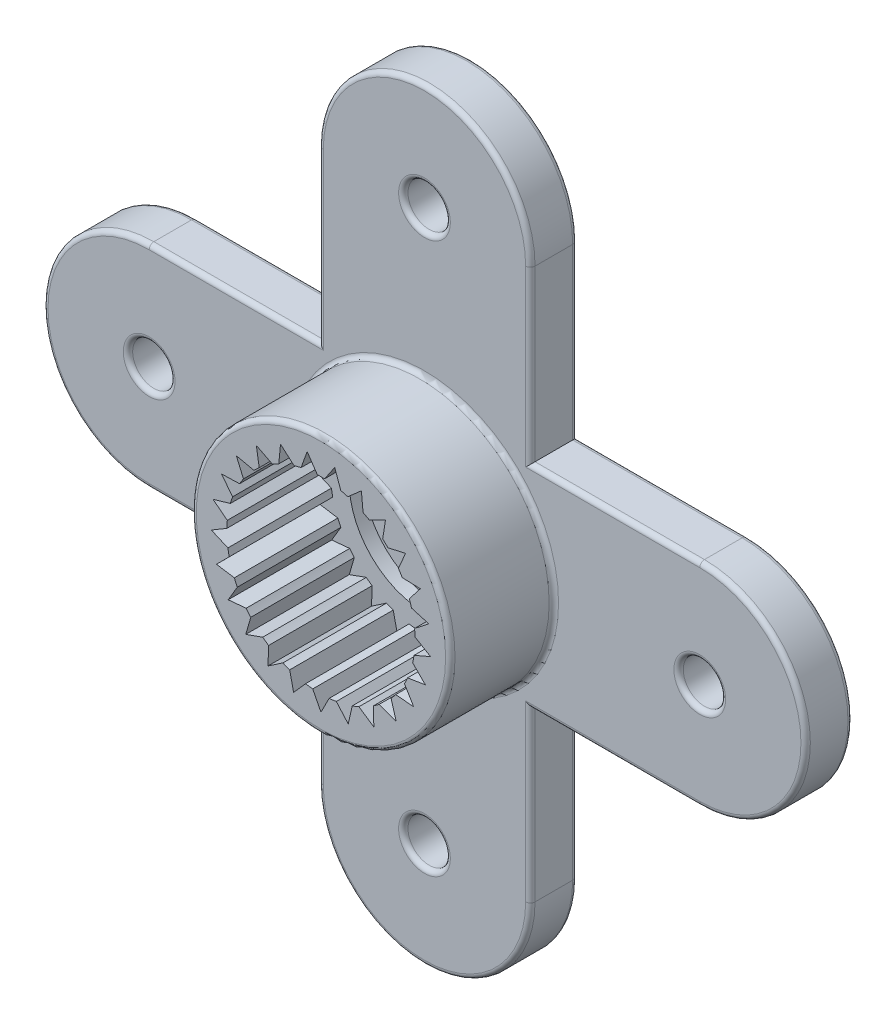
from build123d import *

# Parameters (mm, degrees)
ESQUISSE1_R             = 2.75
BOSS_EXTRU_1_DEPTH      = 1
ESQUISSE2_R             = 2.75
BOSS_EXTRU_2_DEPTH      = 2.2
ESQUISSE3_R             = 2
ENL_V_MAT_EXTRU_1_DEPTH = 2.5
ESQUISSE4_R             = 1.6
ENL_V_MAT_EXTRU_2_DEPTH = 0.4
ESQUISSE5_R             = 0.85
ENL_V_MAT_EXTRU_3_DEPTH = 4.8
ESQUISSE6_R             = 0.45
ENL_V_MAT_EXTRU_4_DEPTH = 10.133044399
CUT_EXTRUDE1_DEPTH      = 2.5
CIRPATTERN1_COUNT       = 25
BOSS_EXTRUDE1_DEPTH     = 1
SKETCH3_R               = 0.45
CUT_EXTRUDE2_DEPTH      = 10.133044399
SKETCH5_R               = 1.6
BOSS_EXTRUDE3_DEPTH     = 1
SKETCH9_R               = 0.45
CUT_EXTRUDE6_DEPTH      = 12.893695809
FILLET5_R               = 0.1


with BuildPart() as part:
    # Esquisse1 → Boss.-Extru.1 (new body)
    with BuildSketch(Plane.XY):
        with BuildLine():
            ThreePointArc((2.25, 5.85), (0, 8.1), (-2.25, 5.85))
            Line((-2.25, 5.85), (-2.25, 1.58113883))
            ThreePointArc((-2.25, 1.58113883), (0, 2.75), (2.25, 1.58113883))
            Line((2.25, 1.58113883), (2.25, 5.85))
        make_face()
        Circle(ESQUISSE1_R)
    extrude(amount=BOSS_EXTRU_1_DEPTH)

    # Esquisse2 → Boss.-Extru.2 (add)
    with BuildSketch(Plane.XY.offset(1)):
        with Locations(Location((0, 0, 0), (0, 0, 144.903198772))):
            Circle(ESQUISSE2_R)
    extrude(amount=BOSS_EXTRU_2_DEPTH)

    # Esquisse3 → Enlèv. mat.-Extru.1 (cut)
    with BuildSketch(Plane.XY.offset(3.2)):
        Circle(ESQUISSE3_R)
    extrude(amount=-ENL_V_MAT_EXTRU_1_DEPTH, mode=Mode.SUBTRACT)

    # Esquisse4 → Enlèv. mat.-Extru.2 (cut)
    with BuildSketch(Plane(origin=(0, 0, 0), x_dir=(-1, 0, 0), z_dir=(0, 0, -1))):
        Circle(ESQUISSE4_R)
    extrude(amount=-ENL_V_MAT_EXTRU_2_DEPTH, mode=Mode.SUBTRACT)

    # Esquisse5 → Enlèv. mat.-Extru.3 (cut)
    with BuildSketch(Plane(origin=(0, 0, 0.4), x_dir=(-1, 0, 0), z_dir=(0, 0, -1))):
        Circle(ESQUISSE5_R)
    extrude(amount=-ENL_V_MAT_EXTRU_3_DEPTH, mode=Mode.SUBTRACT)

    # Esquisse6 → Enlèv. mat.-Extru.4 (cut, through all)
    with BuildSketch(Plane(origin=(0, 0, 0), x_dir=(-1, 0, 0), z_dir=(0, 0, -1))):
        with Locations((0, 5.85)):
            Circle(ESQUISSE6_R)
    extrude(amount=-ENL_V_MAT_EXTRU_4_DEPTH, mode=Mode.SUBTRACT)

    # Sketch1 → Cut-Extrude1 (cut)
    with BuildSketch(Plane.XY.offset(3.2)):
        with BuildLine():
            Line((0.174311485, -1.992389396), (0, -2.334))
            Line((0, -2.334), (-0.174311485, -1.992389396))
            ThreePointArc((-0.174311485, -1.992389396), (0, -2), (0.174311485, -1.992389396))
        make_face()
    cut_extrude1 = extrude(amount=-CUT_EXTRUDE1_DEPTH, mode=Mode.SUBTRACT)

    # CirPattern1: Cut-Extrude1 ×25 about axis
    cirpattern1_axis = Axis((0, 0, 0), (0, 0, 1))
    for i in range(1, CIRPATTERN1_COUNT):
        add(cut_extrude1.rotate(cirpattern1_axis, i * 360 / CIRPATTERN1_COUNT), mode=Mode.SUBTRACT)

    # Sketch2 → Boss-Extrude1 (add)
    with BuildSketch(Plane(origin=(0, 0, 0), x_dir=(-1, 0, 0), z_dir=(0, 0, -1))):
        with BuildLine():
            Line((2.25, -1.58113883), (2.25, -5.85))
            ThreePointArc((2.25, -5.85), (0, -8.1), (-2.25, -5.85))
            Line((-2.25, -5.85), (-2.25, -1.58113883))
            ThreePointArc((-2.25, -1.58113883), (0, -2.75), (2.25, -1.58113883))
        make_face()
    extrude(amount=-BOSS_EXTRUDE1_DEPTH)

    # Sketch3 → Cut-Extrude2 (cut, through all)
    with BuildSketch(Plane(origin=(0, 0, 0), x_dir=(-1, 0, 0), z_dir=(0, 0, -1))):
        with Locations((0, -5.85)):
            Circle(SKETCH3_R)
    extrude(amount=-CUT_EXTRUDE2_DEPTH, mode=Mode.SUBTRACT)

    # Sketch5 → Boss-Extrude3 (add)
    with BuildSketch(Plane(origin=(0, 0, 0), x_dir=(-1, 0, 0), z_dir=(0, 0, -1))):
        with BuildLine():
            Line((5.85, 2.25), (-5.85, 2.25))
            ThreePointArc((-5.85, 2.25), (-8.1, 0), (-5.85, -2.25))
            Line((-5.85, -2.25), (5.85, -2.25))
            ThreePointArc((5.85, -2.25), (8.1, 0), (5.85, 2.25))
        make_face()
        Circle(SKETCH5_R, mode=Mode.SUBTRACT)
    extrude(amount=-BOSS_EXTRUDE3_DEPTH)

    # Sketch9 → Cut-Extrude6 (cut, through all)
    with BuildSketch(Plane(origin=(0, 0, 0), x_dir=(-1, 0, 0), z_dir=(0, 0, -1))):
        with Locations((5.85, 0)):
            Circle(SKETCH9_R)
        with Locations((-5.85, 0)):
            Circle(SKETCH9_R)
    extrude(amount=-CUT_EXTRUDE6_DEPTH, mode=Mode.SUBTRACT)

    # Fillet5
    fillet5_edges = [part.edges().sort_by_distance(p)[0] for p in [
        (-2.25, 4.05, 1),
        (2.25, -1.58113883, 1),
        (2.25, -1.58113883, 3.2),
        (1.6, 0, 0),
        (0, -8.1, 1),
        (0, -8.1, 0),
        (0.45, -5.85, 1),
        (0.45, -5.85, 0),
        (-2.25, -4.05, 1),
        (-2.25, -4.05, 0),
        (2.25, -4.05, 1),
        (2.25, -4.05, 0),
        (0.45, 5.85, 1),
        (0.45, 5.85, 0),
        (-4.05, 2.25, 1),
        (4.05, 2.25, 1),
        (-4.05, -2.25, 1),
        (-4.05, 2.25, 0),
        (-4.05, -2.25, 0),
        (-8.1, 0, 0),
        (-8.1, 0, 1),
        (4.05, -2.25, 1),
        (8.1, 0, 1),
        (4.05, 2.25, 0),
        (8.1, 0, 0),
        (4.05, -2.25, 0),
        (2.25, 4.05, 1),
        (-5.4, 0, 1),
        (-5.4, 0, 0),
        (6.3, 0, 1),
        (6.3, 0, 0),
        (-2.25, 4.05, 0),
        (0, 8.1, 0),
        (2.25, 4.05, 0),
        (0, 8.1, 1),
    ]]
    fillet(fillet5_edges, radius=FILLET5_R)


solid = part.part
